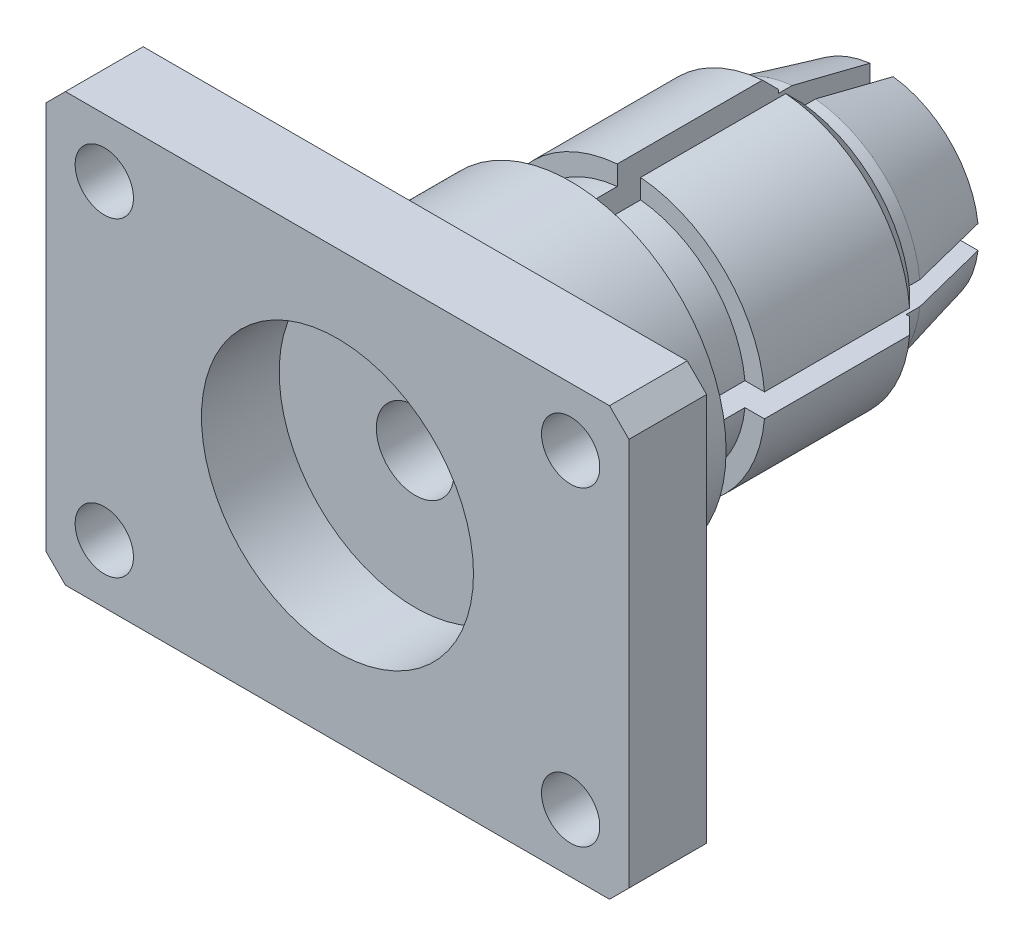
from build123d import *

# Parameters (mm, degrees)
SKETCH_1_W                 = 15
SKETCH_1_H                 = 22
SKETCH_1_R                 = 1.5
EXTRUDE_1_DEPTH            = 4
CHAMFER_1_SIZE             = 1
CHAMFER_1_OF_MIRROR_1_SIZE = 1
SKETCH_2_R                 = 2
CUT_EXTRUDE_1_DEPTH        = 26.362373706
EXTRUDE_START              = 8
SKETCH_3_R                 = 8
SKETCH_3_R_2               = 2
EXTRUDE_2_DEPTH            = 8
EXTRUDE_3_DEPTH            = 16
CHAMFER_2_SIZE             = 4
CHAMFER_2_SIZE2            = 1
EXTRUDE_START_2            = 3
SKETCH_5_R                 = 7
SKETCH_5_R_2               = 4.5
EXTRUDE_4_DEPTH            = 8.3
CHAMFER_3_SIZE             = 0.828
EXTRUDE_START_3            = -11.8
SKETCH_6_R                 = 4.5
SKETCH_6_R_2               = 3.4455
EXTRUDE_5_DEPTH            = 11.8
CHAMFER_4_SIZE             = 0.5545
CUT_EXTRUDE_3_DEPTH        = 30.719522203
SKETCH_7_R                 = 7
CUT_EXTRUDE_4_DEPTH        = 4


with BuildPart() as part:
    # Эскиз1 → Бобышка-Вытянуть1 (new body)
    with BuildSketch(Plane.XY):
        Rectangle(SKETCH_1_W, SKETCH_1_H)
        with Locations((-4.5, 8)):
            Circle(SKETCH_1_R, mode=Mode.SUBTRACT)
        with Locations((-4.5, -8)):
            Circle(SKETCH_1_R, mode=Mode.SUBTRACT)
    extrude_1 = extrude(amount=EXTRUDE_1_DEPTH)

    # Фаска1
    chamfer_1_edges = [part.edges().sort_by_distance(p)[0] for p in [
        (-7.5, -11, 2),
        (-7.5, 11, 2),
    ]]
    chamfer(chamfer_1_edges, length=CHAMFER_1_SIZE)

    # Зеркальное отражение1: Бобышка-Вытянуть1 across plane
    add(extrude_1.mirror(Plane(origin=(7.5, -11, 4), x_dir=(0, 0, 1), z_dir=(-1, 0, 0))))

    # Фаска1 of Зеркальное отражение1
    chamfer_1_of_mirror_1_edges = [part.edges().sort_by_distance(p)[0] for p in [
        (22.5, -11, 2),
        (22.5, 11, 2),
    ]]
    chamfer(chamfer_1_of_mirror_1_edges, length=CHAMFER_1_OF_MIRROR_1_SIZE)

    # Эскиз2 → Вырез-Вытянуть1 (cut, through all)
    with BuildSketch(Plane(origin=(0, 0, 0), x_dir=(-1, 0, 0), z_dir=(0, 0, -1))):
        with Locations((-7.5, 0)):
            Circle(SKETCH_2_R)
    extrude(amount=-CUT_EXTRUDE_1_DEPTH, mode=Mode.SUBTRACT)

    # Эскиз3 → Бобышка-Вытянуть2 (add)
    with BuildSketch(Plane(origin=(0, 0, 0), x_dir=(-1, 0, 0), z_dir=(0, 0, -1)).offset(EXTRUDE_START)):
        with Locations((-7.5, 0)):
            Circle(SKETCH_3_R)
        with Locations((-7.5, 0)):
            Circle(SKETCH_3_R_2, mode=Mode.SUBTRACT)
    extrude(amount=-EXTRUDE_2_DEPTH)

    # Эскиз4 → Бобышка-Вытянуть3 (add)
    with BuildSketch(Plane(origin=(0, 0, -8), x_dir=(-1, 0, 0), z_dir=(0, 0, -1))):
        with BuildLine():
            Line((-8.1, 4.459820624), (-8.1, 5.969924623))
            ThreePointArc((-8.1, 5.969924623), (-11.742640687, 4.242640687), (-13.469924623, 0.6))
            Line((-13.469924623, 0.6), (-11.959820624, 0.6))
            ThreePointArc((-11.959820624, 0.6), (-10.681980515, 3.181980515), (-8.1, 4.459820624))
        make_face()
        with BuildLine():
            Line((-6.9, 4.459820624), (-6.9, 5.969924623))
            ThreePointArc((-6.9, 5.969924623), (-7.5, 6), (-8.1, 5.969924623))
            Line((-8.1, 5.969924623), (-8.1, 4.459820624))
            ThreePointArc((-8.1, 4.459820624), (-7.5, 4.5), (-6.9, 4.459820624))
        make_face()
        with BuildLine():
            ThreePointArc((-8.1, -5.969924623), (-7.5, -6), (-6.9, -5.969924623))
            Line((-6.9, -5.969924623), (-6.9, -4.459820624))
            ThreePointArc((-6.9, -4.459820624), (-7.5, -4.5), (-8.1, -4.459820624))
            Line((-8.1, -4.459820624), (-8.1, -5.969924623))
        make_face()
        with BuildLine():
            Line((-3.040179376, 0.6), (-1.530075377, 0.6))
            ThreePointArc((-1.530075377, 0.6), (-3.257359313, 4.242640687), (-6.9, 5.969924623))
            Line((-6.9, 5.969924623), (-6.9, 4.459820624))
            ThreePointArc((-6.9, 4.459820624), (-4.318019485, 3.181980515), (-3.040179376, 0.6))
        make_face()
        with BuildLine():
            ThreePointArc((-1.5, 0), (-1.507523561, 0.30037665), (-1.530075377, 0.6))
            Line((-1.530075377, 0.6), (-3.040179376, 0.6))
            ThreePointArc((-3.040179376, 0.6), (-3.01005608, 0.300671907), (-3, 0))
            ThreePointArc((-3, 0), (-3.01005608, -0.300671907), (-3.040179376, -0.6))
            Line((-3.040179376, -0.6), (-1.530075377, -0.6))
            ThreePointArc((-1.530075377, -0.6), (-1.507523561, -0.30037665), (-1.5, 0))
        make_face()
        with BuildLine():
            Line((-11.959820624, 0.6), (-13.469924623, 0.6))
            ThreePointArc((-13.469924623, 0.6), (-13.5, 0), (-13.469924623, -0.6))
            Line((-13.469924623, -0.6), (-11.959820624, -0.6))
            ThreePointArc((-11.959820624, -0.6), (-12, 0), (-11.959820624, 0.6))
        make_face()
        with BuildLine():
            ThreePointArc((-6.9, -5.969924623), (-3.257359313, -4.242640687), (-1.530075377, -0.6))
            Line((-1.530075377, -0.6), (-3.040179376, -0.6))
            ThreePointArc((-3.040179376, -0.6), (-4.318019485, -3.181980515), (-6.9, -4.459820624))
            Line((-6.9, -4.459820624), (-6.9, -5.969924623))
        make_face()
        with BuildLine():
            ThreePointArc((-13.469924623, -0.6), (-11.742640687, -4.242640687), (-8.1, -5.969924623))
            Line((-8.1, -5.969924623), (-8.1, -4.459820624))
            ThreePointArc((-8.1, -4.459820624), (-10.681980515, -3.181980515), (-11.959820624, -0.6))
            Line((-11.959820624, -0.6), (-13.469924623, -0.6))
        make_face()
    extrude(amount=EXTRUDE_3_DEPTH)

    # Фаска2
    chamfer_2_edges = [part.edges().sort_by_distance(p)[0] for p in [
        (2.854361747, 3.797110115, -24),
    ]]
    chamfer_2_side = [part.faces().sort_by_distance(p)[0] for p in [
        (2.854361747, 3.797110115, -16),
    ]]
    chamfer(chamfer_2_edges, length=CHAMFER_2_SIZE, length2=CHAMFER_2_SIZE2, reference=chamfer_2_side[0])

    # Эскиз5 → Бобышка-Вытянуть4 (add)
    with BuildSketch(Plane(origin=(0, 0, -8), x_dir=(-1, 0, 0), z_dir=(0, 0, -1)).offset(EXTRUDE_START_2)):
        with Locations(Location((-7.5, 0, 0), (0, 0, 180))):
            Circle(SKETCH_5_R)
        with Locations((-7.5, 0)):
            Circle(SKETCH_5_R_2, mode=Mode.SUBTRACT)
    extrude(amount=EXTRUDE_4_DEPTH)

    # Фаска3
    chamfer_3_edges = [part.edges().sort_by_distance(p)[0] for p in [
        (0.5, 0, -19.3),
    ]]
    chamfer(chamfer_3_edges, length=CHAMFER_3_SIZE)

    # Эскиз6 → Бобышка-Вытянуть5 (add)
    with BuildSketch(Plane(origin=(0, 0, -24), x_dir=(-1, 0, 0), z_dir=(0, 0, -1)).offset(EXTRUDE_START_3)):
        with Locations((-7.5, 0)):
            Circle(SKETCH_6_R)
        with Locations((-7.5, 0)):
            Circle(SKETCH_6_R_2, mode=Mode.SUBTRACT)
    extrude(amount=EXTRUDE_5_DEPTH)

    # Фаска4
    chamfer_4_edges = [part.edges().sort_by_distance(p)[0] for p in [
        (10.9455, 0, -24),
    ]]
    chamfer(chamfer_4_edges, length=CHAMFER_4_SIZE)

    # Эскиз4<4> → Вырез-Вытянуть3 (cut, through all)
    with BuildSketch(Plane(origin=(0, 0, -8), x_dir=(-1, 0, 0), z_dir=(0, 0, -1))):
        with BuildLine():
            Line((-6.9, 5.969924623), (-6.9, 7.97746827))
            ThreePointArc((-6.9, 7.97746827), (-7.199788542, 7.994365083), (-7.5, 8))
            ThreePointArc((-7.5, 8), (-7.800211458, 7.994365083), (-8.1, 7.97746827))
            Line((-8.1, 7.97746827), (-8.1, 5.969924623))
            ThreePointArc((-8.1, 5.969924623), (-7.5, 6), (-6.9, 5.969924623))
        make_face()
        with BuildLine():
            ThreePointArc((-7.5, -8), (-7.199788542, -7.994365083), (-6.9, -7.97746827))
            Line((-6.9, -7.97746827), (-6.9, -5.969924623))
            ThreePointArc((-6.9, -5.969924623), (-7.5, -6), (-8.1, -5.969924623))
            Line((-8.1, -5.969924623), (-8.1, -7.97746827))
            ThreePointArc((-8.1, -7.97746827), (-7.800211458, -7.994365083), (-7.5, -8))
        make_face()
        with BuildLine():
            Line((-6.9, 4.459820624), (-6.9, 5.969924623))
            ThreePointArc((-6.9, 5.969924623), (-7.5, 6), (-8.1, 5.969924623))
            Line((-8.1, 5.969924623), (-8.1, 4.459820624))
            ThreePointArc((-8.1, 4.459820624), (-7.5, 4.5), (-6.9, 4.459820624))
        make_face()
        with BuildLine():
            ThreePointArc((-8.1, -5.969924623), (-7.5, -6), (-6.9, -5.969924623))
            Line((-6.9, -5.969924623), (-6.9, -4.459820624))
            ThreePointArc((-6.9, -4.459820624), (-7.5, -4.5), (-8.1, -4.459820624))
            Line((-8.1, -4.459820624), (-8.1, -5.969924623))
        make_face()
        with BuildLine():
            Line((-6.9, 1.907878403), (-6.9, 4.459820624))
            ThreePointArc((-6.9, 4.459820624), (-7.5, 4.5), (-8.1, 4.459820624))
            Line((-8.1, 4.459820624), (-8.1, 1.907878403))
            ThreePointArc((-8.1, 1.907878403), (-7.5, 2), (-6.9, 1.907878403))
        make_face()
        with BuildLine():
            ThreePointArc((-8.1, -4.459820624), (-7.5, -4.5), (-6.9, -4.459820624))
            Line((-6.9, -4.459820624), (-6.9, -1.907878403))
            ThreePointArc((-6.9, -1.907878403), (-7.5, -2), (-8.1, -1.907878403))
            Line((-8.1, -1.907878403), (-8.1, -4.459820624))
        make_face()
        with BuildLine():
            ThreePointArc((0.5, 0), (0.494365083, 0.300211458), (0.47746827, 0.6))
            Line((0.47746827, 0.6), (-1.530075377, 0.6))
            ThreePointArc((-1.530075377, 0.6), (-1.507523561, 0.30037665), (-1.5, 0))
            ThreePointArc((-1.5, 0), (-1.507523561, -0.30037665), (-1.530075377, -0.6))
            Line((-1.530075377, -0.6), (0.47746827, -0.6))
            ThreePointArc((0.47746827, -0.6), (0.494365083, -0.300211458), (0.5, 0))
        make_face()
        with BuildLine():
            ThreePointArc((-13.469924623, -0.6), (-13.5, 0), (-13.469924623, 0.6))
            Line((-13.469924623, 0.6), (-15.47746827, 0.6))
            ThreePointArc((-15.47746827, 0.6), (-15.494365083, 0.300211458), (-15.5, 0))
            ThreePointArc((-15.5, 0), (-15.494365083, -0.300211458), (-15.47746827, -0.6))
            Line((-15.47746827, -0.6), (-13.469924623, -0.6))
        make_face()
        with BuildLine():
            ThreePointArc((-1.5, 0), (-1.507523561, 0.30037665), (-1.530075377, 0.6))
            Line((-1.530075377, 0.6), (-3.040179376, 0.6))
            ThreePointArc((-3.040179376, 0.6), (-3.01005608, 0.300671907), (-3, 0))
            ThreePointArc((-3, 0), (-3.01005608, -0.300671907), (-3.040179376, -0.6))
            Line((-3.040179376, -0.6), (-1.530075377, -0.6))
            ThreePointArc((-1.530075377, -0.6), (-1.507523561, -0.30037665), (-1.5, 0))
        make_face()
        with BuildLine():
            Line((-11.959820624, 0.6), (-13.469924623, 0.6))
            ThreePointArc((-13.469924623, 0.6), (-13.5, 0), (-13.469924623, -0.6))
            Line((-13.469924623, -0.6), (-11.959820624, -0.6))
            ThreePointArc((-11.959820624, -0.6), (-12, 0), (-11.959820624, 0.6))
        make_face()
        with BuildLine():
            ThreePointArc((-3, 0), (-3.01005608, 0.300671907), (-3.040179376, 0.6))
            Line((-3.040179376, 0.6), (-5.592121597, 0.6))
            ThreePointArc((-5.592121597, 0.6), (-5.523164548, 0.303515399), (-5.5, 0))
            ThreePointArc((-5.5, 0), (-5.523164548, -0.303515399), (-5.592121597, -0.6))
            Line((-5.592121597, -0.6), (-3.040179376, -0.6))
            ThreePointArc((-3.040179376, -0.6), (-3.01005608, -0.300671907), (-3, 0))
        make_face()
        with BuildLine():
            Line((-9.407878403, 0.6), (-11.959820624, 0.6))
            ThreePointArc((-11.959820624, 0.6), (-12, 0), (-11.959820624, -0.6))
            Line((-11.959820624, -0.6), (-9.407878403, -0.6))
            ThreePointArc((-9.407878403, -0.6), (-9.5, 0), (-9.407878403, 0.6))
        make_face()
    extrude(amount=CUT_EXTRUDE_3_DEPTH, mode=Mode.SUBTRACT)

    # Эскиз7 → Вырез-Вытянуть4 (cut)
    with BuildSketch(Plane.XY.offset(4)):
        with Locations((7.5, 0)):
            Circle(SKETCH_7_R)
    extrude(amount=-CUT_EXTRUDE_4_DEPTH, mode=Mode.SUBTRACT)


solid = part.part
